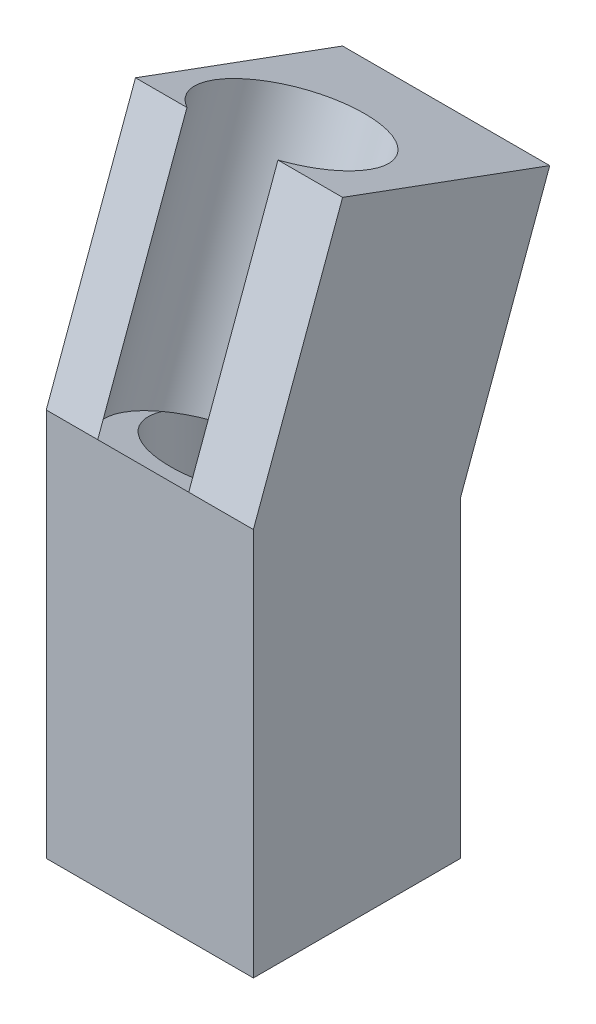
from build123d import *

# Parameters (mm, degrees)
SKETCH1_W           = 8
SKETCH1_H           = 8
SKETCH1_R           = 3
BOSS_EXTRUDE3_DEPTH = 15
CUT_EXTRUDE1_DEPTH  = 8
SKETCH4_W           = 8
SKETCH4_H           = 8.522050623
BOSS_EXTRUDE4_DEPTH = 10
SKETCH5_R           = 3
CUT_EXTRUDE2_DEPTH  = 10


with BuildPart() as part:
    # Sketch1 → Boss-Extrude3 (new body)
    with BuildSketch(Plane(origin=(0, 0, 0), x_dir=(1, 0, 0), z_dir=(0, 1, 0))):
        with Locations((4, 4)):
            Rectangle(SKETCH1_W, SKETCH1_H)
        with Locations(Location((3.995564868, 3.791433264, 0), (0, 0, 270))):
            Circle(SKETCH1_R, mode=Mode.SUBTRACT)
    extrude(amount=BOSS_EXTRUDE3_DEPTH)

    # Sketch3 → Cut-Extrude1 (cut)
    with BuildSketch(Plane.ZY):
        Polygon((-8, 15), (0, 15), (-8, 12.063105925), align=None)
    extrude(amount=-CUT_EXTRUDE1_DEPTH, mode=Mode.SUBTRACT)

    # Sketch4 → Boss-Extrude4 (add)
    with BuildSketch(Plane(origin=(0, 13.218525518, -4.852676159), x_dir=(1, 0, 0), z_dir=(0, 0.9387411967802677, -0.3446229323007264))):
        with Locations((4, -0.908318673)):
            Rectangle(SKETCH4_W, SKETCH4_H)
    extrude(amount=BOSS_EXTRUDE4_DEPTH)

    # Sketch5 → Cut-Extrude2 (cut)
    with BuildSketch(Plane(origin=(0, 22.605937486, -8.298905482), x_dir=(1, 0, 0), z_dir=(0, 0.9387411967802677, -0.34462293230072644))):
        with Locations((3.74552854, -2.73801251)):
            Circle(SKETCH5_R)
    extrude(amount=-CUT_EXTRUDE2_DEPTH, mode=Mode.SUBTRACT)


solid = part.part
